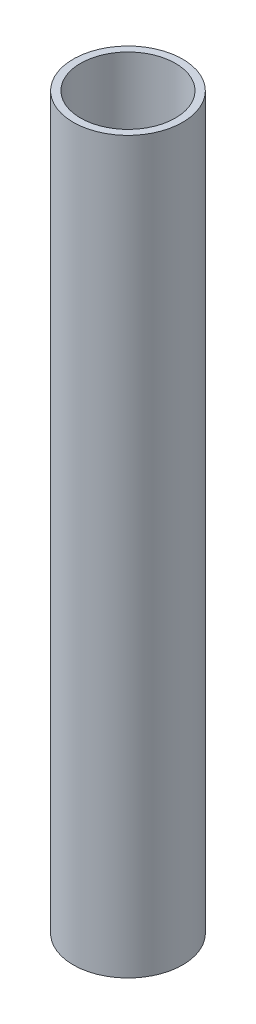
from build123d import *

# Parameters (mm, degrees)
SKETCH1_R           = 7.5
SKETCH1_R_2         = 6.5
EXTRUDE_THIN1_DEPTH = 100


with BuildPart() as part:
    # Sketch1 → Extrude-Thin1 (new body)
    with BuildSketch(Plane(origin=(0, 0, 0), x_dir=(1, 0, 0), z_dir=(0, 1, 0))):
        Circle(SKETCH1_R)
        Circle(SKETCH1_R_2, mode=Mode.SUBTRACT)
    extrude(amount=EXTRUDE_THIN1_DEPTH)


solid = part.part
